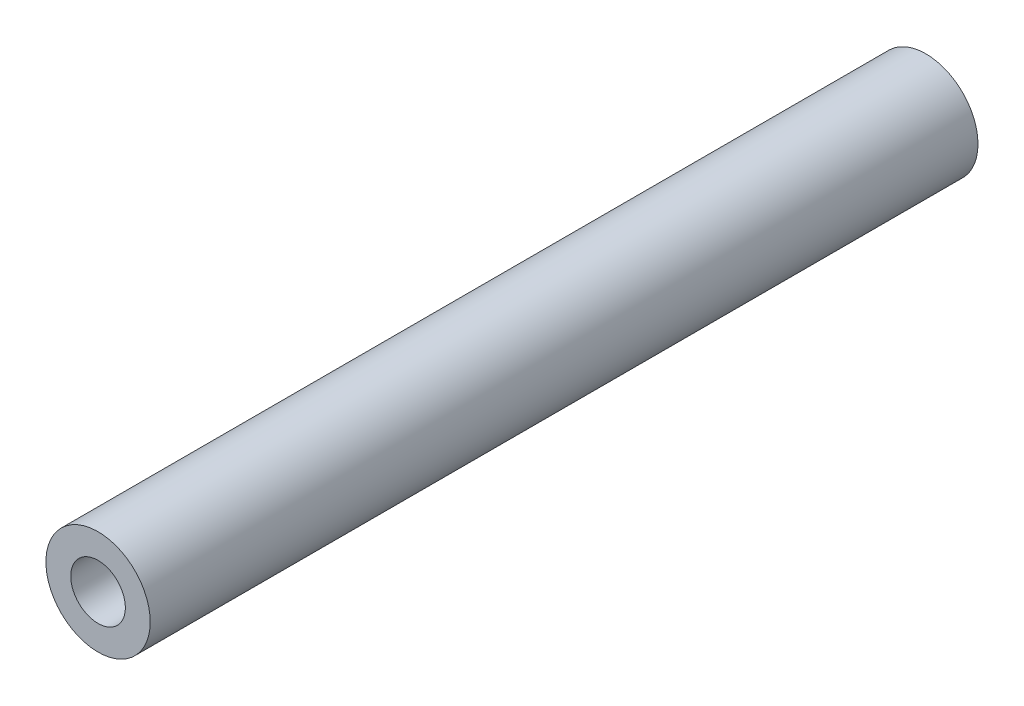
from build123d import *

# Parameters (mm, degrees)
SKETCH1_R           = 3.15
SKETCH1_R_2         = 1.65
BOSS_EXTRUDE1_DEPTH = 50


with BuildPart() as part:
    # Sketch1 → Boss-Extrude1 (new body)
    with BuildSketch(Plane.XY):
        Circle(SKETCH1_R)
        Circle(SKETCH1_R_2, mode=Mode.SUBTRACT)
    extrude(amount=BOSS_EXTRUDE1_DEPTH)


solid = part.part
